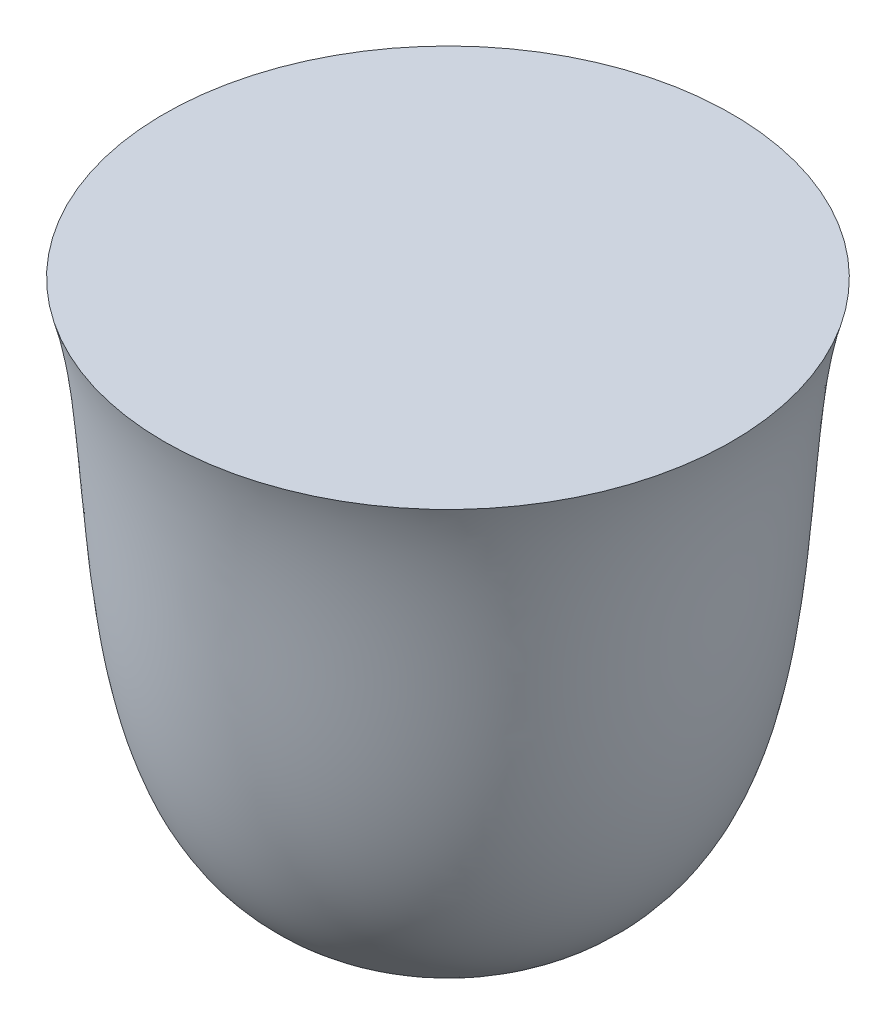
from build123d import *


with BuildPart() as part:
    # Sketch1 → Revolve5 (revolve)
    with BuildSketch(Plane.XY, mode=Mode.PRIVATE) as revolve5_sk:
        with BuildLine():
            Line((7.36313478, -146), (7.36313478, -145.863134178))
            ThreePointArc((7.36313478, -145.863134178), (8.452372267, -143.119512193), (11.126865577, -141.870118167))
            add(Edge.make_bspline(
                [(11.126865577, -141.870118167), (26.038790696, -140.987770424), (76.350621672, -116.580239955), (64.410680244, -34.50712047), (75, 0)],
                knots=[0.017667594, 0.017667594, 0.017667594, 0.017667594, 0.232438423, 1, 1, 1, 1], degree=3))
            Line((75, 0), (0, 0))
            Line((0, 0), (0, -150))
            Line((0, -150), (3.36313478, -150))
            ThreePointArc((3.36313478, -150), (6.191561904, -148.828427125), (7.36313478, -146))
        make_face()
    revolve(revolve5_sk.sketch.rotate(Axis((0, 0, 0), (0, -1, 0)), 90), axis=Axis((0, 0, 0), (0, -1, 0)))


solid = part.part
